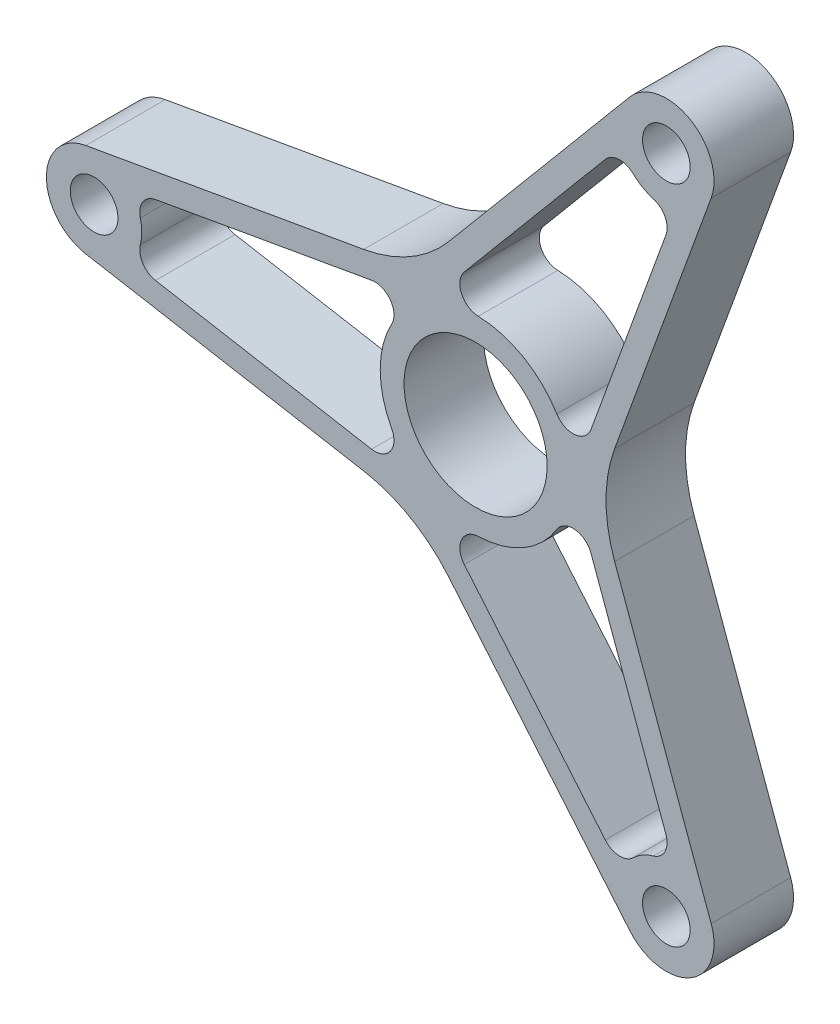
from build123d import *

# Parameters (mm, degrees)
SKETCH1_R           = 9
SKETCH1_R_2         = 3
BOSS_EXTRUDE2_DEPTH = 10


with BuildPart() as part:
    # Sketch1 → Boss-Extrude2 (new body)
    with BuildSketch(Plane.XY):
        with BuildLine():
            Line((-49.041889066, 5.908846518), (-14.079486813, 12.073661346))
            ThreePointArc((-14.079486813, 12.073661346), (-8.205154011, 14.211743632), (-3.416354035, 18.230023925))
            Line((-3.416354035, 18.230023925), (19.403733341, 45.42594504))
            ThreePointArc((19.403733341, 45.42594504), (27, 46.765371804), (29.638155725, 39.517098522))
            Line((29.638155725, 39.517098522), (17.495840849, 6.15636258))
            ThreePointArc((17.495840849, 6.15636258), (16.410308023, 0), (17.495840849, -6.15636258))
            Line((17.495840849, -6.15636258), (29.638155725, -39.517098522))
            ThreePointArc((29.638155725, -39.517098522), (27, -46.765371804), (19.403733341, -45.42594504))
            Line((19.403733341, -45.42594504), (-3.416354035, -18.230023925))
            ThreePointArc((-3.416354035, -18.230023925), (-8.205154011, -14.211743632), (-14.079486813, -12.073661346))
            Line((-14.079486813, -12.073661346), (-49.041889066, -5.908846518))
            ThreePointArc((-49.041889066, -5.908846518), (-54, 0), (-49.041889066, 5.908846518))
        make_face()
        Circle(SKETCH1_R, mode=Mode.SUBTRACT)
        with Locations((-48, 0)):
            Circle(SKETCH1_R_2, mode=Mode.SUBTRACT)
        with Locations((24, 41.569219382)):
            Circle(SKETCH1_R_2, mode=Mode.SUBTRACT)
        with Locations((24, -41.569219382)):
            Circle(SKETCH1_R_2, mode=Mode.SUBTRACT)
        with BuildLine():
            Line((-40.269689417, 4.409342161), (-13.089403061, 9.201959989))
            ThreePointArc((-13.089403061, 9.201959989), (-10.726679899, 8.24313144), (-10.560539529, 5.698684484))
            ThreePointArc((-10.560539529, 5.698684484), (-12, 0), (-10.560539529, -5.698684484))
            ThreePointArc((-10.560539529, -5.698684484), (-10.726679899, -8.24313144), (-13.089403061, -9.201959989))
            Line((-13.089403061, -9.201959989), (-40.269689417, -4.409342161))
            ThreePointArc((-40.269689417, -4.409342161), (-41.866838007, -3.351249763), (-42.180666993, -1.461288252))
            ThreePointArc((-42.180666993, -1.461288252), (-42, 0), (-42.180666993, 1.461288252))
            ThreePointArc((-42.180666993, 1.461288252), (-41.866838007, 3.351249763), (-40.269689417, 4.409342161))
        make_face(mode=Mode.SUBTRACT)
        with BuildLine():
            Line((23.953447034, 32.669902957), (14.513832645, 6.734775577))
            ThreePointArc((14.513832645, 6.734775577), (12.502101183, 5.168011571), (10.215475296, 6.296353268))
            ThreePointArc((10.215475296, 6.296353268), (6, 10.392304845), (0.345064233, 11.995037752))
            ThreePointArc((0.345064233, 11.995037752), (-1.775421284, 13.41114301), (-1.424429584, 15.936735566))
            Line((-1.424429584, 15.936735566), (16.316242383, 37.079245118))
            ThreePointArc((16.316242383, 37.079245118), (18.031151575, 37.933370172), (19.824820748, 37.260173291))
            ThreePointArc((19.824820748, 37.260173291), (21, 36.373066959), (22.355846246, 35.798885039))
            ThreePointArc((22.355846246, 35.798885039), (23.835686433, 34.582120409), (23.953447034, 32.669902957))
        make_face(mode=Mode.SUBTRACT)
        with BuildLine():
            Line((16.316242383, -37.079245118), (-1.424429584, -15.936735566))
            ThreePointArc((-1.424429584, -15.936735566), (-1.775421284, -13.41114301), (0.345064233, -11.995037752))
            ThreePointArc((0.345064233, -11.995037752), (6, -10.392304845), (10.215475296, -6.296353268))
            ThreePointArc((10.215475296, -6.296353268), (12.502101183, -5.168011571), (14.513832645, -6.734775577))
            Line((14.513832645, -6.734775577), (23.953447034, -32.669902957))
            ThreePointArc((23.953447034, -32.669902957), (23.835686433, -34.582120409), (22.355846246, -35.798885039))
            ThreePointArc((22.355846246, -35.798885039), (21, -36.373066959), (19.824820748, -37.260173291))
            ThreePointArc((19.824820748, -37.260173291), (18.031151575, -37.933370172), (16.316242383, -37.079245118))
        make_face(mode=Mode.SUBTRACT)
    extrude(amount=BOSS_EXTRUDE2_DEPTH)


solid = part.part
